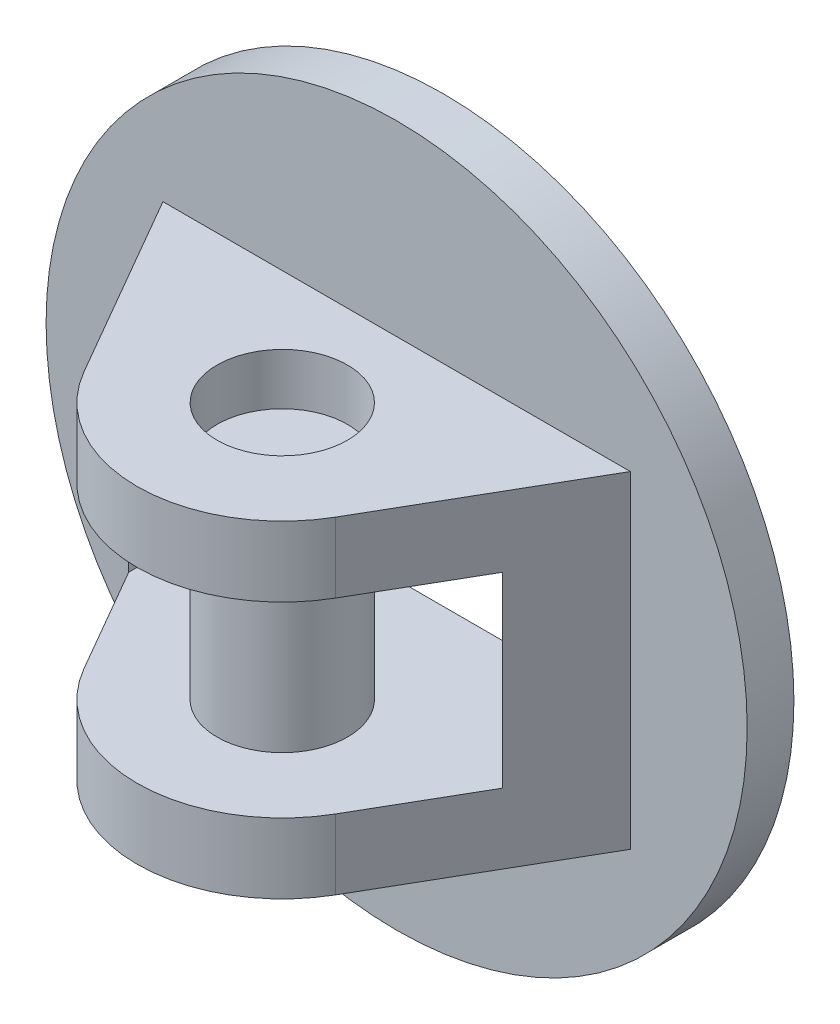
from build123d import *

# Parameters (mm, degrees)
SKETCH2_R               = 37.5
EXTRUDE1_DEPTH          = 5
SKETCH4_R               = 6.975515666
EXTRUDE2_DEPTH          = 17.5
CUT_EXTRUDE3_DEPTH      = 60.86243639
CUT_EXTRUDE3_DEPTH_BACK = 60.86243639
SKETCH5_W               = 40
SKETCH5_H               = 20
EXTRUDE3_DEPTH          = 22
EXTRUDE3_DEPTH_BACK     = 2
SKETCH6_R               = 6.975


with BuildPart() as part:
    # Sketch2 → Extrude1 (new body)
    with BuildSketch(Plane.XY):
        Circle(SKETCH2_R)
    extrude(amount=EXTRUDE1_DEPTH)

    # Sketch4 → Extrude2 (add, symmetric)
    with BuildSketch(Plane(origin=(0, 0, 0), x_dir=(-1, 0, 0), z_dir=(0, 1, 0))):
        with BuildLine():
            Line((-25, 5), (25, 5))
            Line((25, 5), (13.452994616, 25))
            ThreePointArc((13.452994616, 25), (0, 32.767090063), (-13.452994616, 25))
            Line((-13.452994616, 25), (-25, 5))
        make_face()
        with Locations(Location((0, 17.232909937, 0), (0, 0, 90))):
            Circle(SKETCH4_R, mode=Mode.SUBTRACT)
    extrude(amount=EXTRUDE2_DEPTH, both=True)

    # Sketch5 → Cut-Extrude3 (cut, two sides: drawn at the far end of the back side and taken through both)
    with BuildSketch(Plane.XY.offset(5).offset(-CUT_EXTRUDE3_DEPTH_BACK)):
        Rectangle(SKETCH5_W, SKETCH5_H)
    extrude(amount=CUT_EXTRUDE3_DEPTH + CUT_EXTRUDE3_DEPTH_BACK, mode=Mode.SUBTRACT)


with BuildPart() as body_2:
    # Sketch6 → Extrude3 (new, two sides: drawn at the far end of the back side and taken through both)
    with BuildSketch(Plane(origin=(0, -10, 0), x_dir=(-1, 0, 0), z_dir=(0, 1, 0)).offset(-EXTRUDE3_DEPTH_BACK)):
        with Locations(Location((0, 17.232909937, 0), (0, 0, 90))):
            Circle(SKETCH6_R)
    extrude(amount=EXTRUDE3_DEPTH + EXTRUDE3_DEPTH_BACK)


solid = Compound([part.part, body_2.part])
